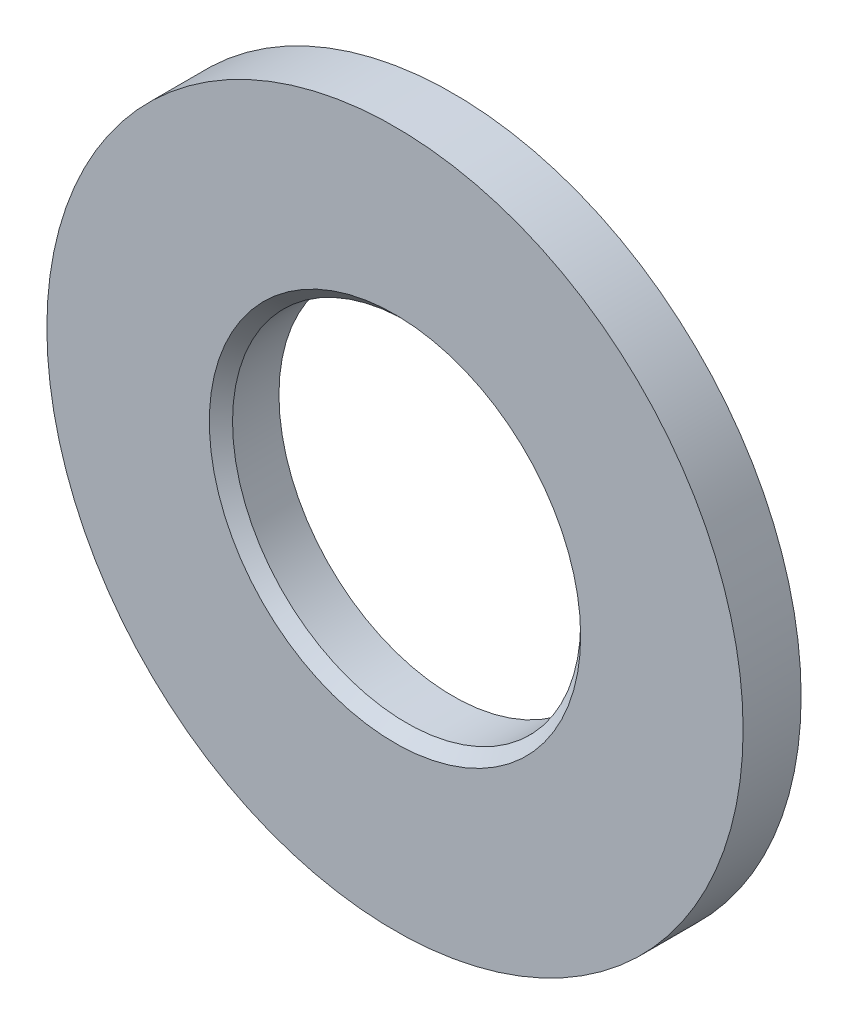
from build123d import *

# Parameters (mm, degrees)
SKETCH_1_R      = 6
SKETCH_1_R_2    = 3
EXTRUDE_1_DEPTH = 1
CHAMFER_1_SIZE  = 0.2


with BuildPart() as part:
    # Эскиз1 → Бобышка-Вытянуть1 (new body)
    with BuildSketch(Plane.XY):
        Circle(SKETCH_1_R)
        Circle(SKETCH_1_R_2, mode=Mode.SUBTRACT)
    extrude(amount=EXTRUDE_1_DEPTH)

    # Фаска1
    chamfer_1_edges = [part.edges().sort_by_distance(p)[0] for p in [
        (-3, 0, 1),
    ]]
    chamfer(chamfer_1_edges, length=CHAMFER_1_SIZE)


solid = part.part
